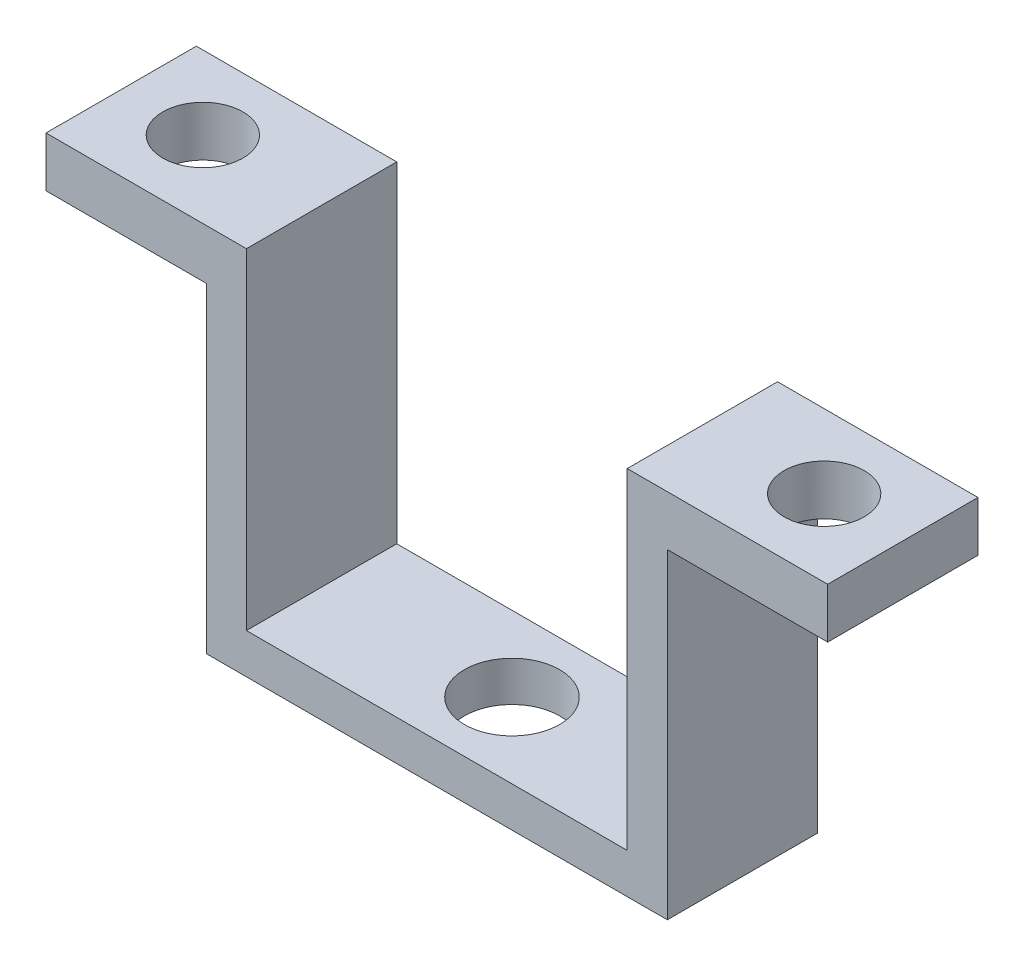
from build123d import *

# Parameters (mm, degrees)
RESSALTO_EXTRUS_O1_DEPTH   = 7.5
CORTE_EXTRUS_O2_DEPTH      = 55.27936993
CORTE_EXTRUS_O2_DEPTH_BACK = 55.27936993
ESBO_O3_R                  = 4.75
CORTE_EXTRUS_O3_DEPTH      = 52.002450921
CORTE_EXTRUS_O3_DEPTH_BACK = 52.002450921
ESBO_O4_R                  = 4


with BuildPart() as part:
    # Esboço1 → Ressalto-extrusão1 (new, symmetric)
    with BuildSketch(Plane.XY):
        Polygon((19, 0), (-19, 0), (-19, 33), (-39, 33), (-39, 28), (-23, 28), (-23, -4), (23, -4), (23, 28), (39, 28), (39, 33), (19, 33), align=None)
    extrude(amount=RESSALTO_EXTRUS_O1_DEPTH, both=True)

    # Esboço3 → Corte-extrusão2 (cut, two sides: drawn at the far end of the back side and taken through both)
    with BuildSketch(Plane(origin=(0, -4, 0), x_dir=(-1, 0, 0), z_dir=(0, -1, 0)).offset(-CORTE_EXTRUS_O2_DEPTH_BACK)):
        with Locations(Location((0, 0, 0), (0, 0, 90))):
            Circle(ESBO_O3_R)
    extrude(amount=CORTE_EXTRUS_O2_DEPTH + CORTE_EXTRUS_O2_DEPTH_BACK, mode=Mode.SUBTRACT)

    # Esboço4 → Corte-extrusão3 (cut, two sides: drawn at the far end of the back side and taken through both)
    with BuildSketch(Plane(origin=(0, 28, 0), x_dir=(-1, 0, 0), z_dir=(0, -1, 0)).offset(-CORTE_EXTRUS_O3_DEPTH_BACK)):
        with Locations(Location((31, 0.149250584, 0), (0, 0, 90))):
            Circle(ESBO_O4_R)
        with Locations(Location((-31, 0.149250584, 0), (0, 0, 90))):
            Circle(ESBO_O4_R)
    extrude(amount=CORTE_EXTRUS_O3_DEPTH + CORTE_EXTRUS_O3_DEPTH_BACK, mode=Mode.SUBTRACT)


solid = part.part
